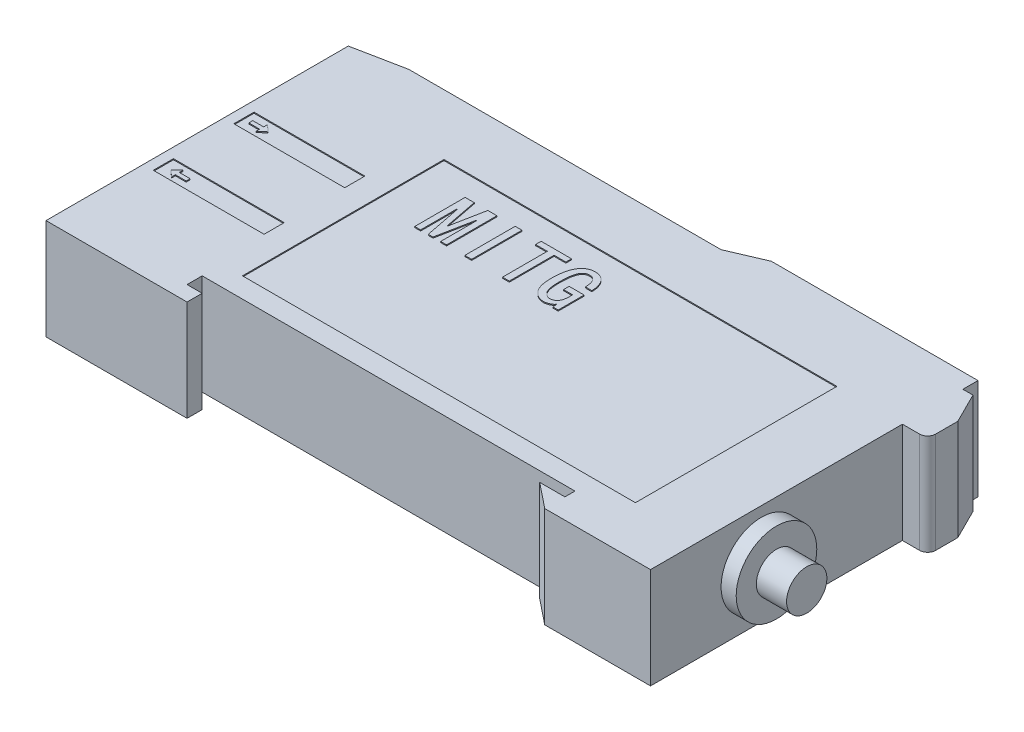
from build123d import *

# Parameters (mm, degrees)
SKETCH_1_W          = 60
SKETCH_1_H          = 31
EXTRUDE_1_DEPTH     = 10
CUT_EXTRUDE_1_DEPTH = 10
EXTRUDE_2_DEPTH     = 10
SKETCH_4_R          = 1
CUT_EXTRUDE_2_DEPTH = 10
SKETCH_5_W          = 39
SKETCH_5_H          = 20
SKETCH_5_W_2        = 0.67251462
SKETCH_5_H_2        = 5
SKETCH_5_W_3        = 11
SKETCH_5_H_3        = 2
CUT_EXTRUDE_3_DEPTH = 0.1
SKETCH_6_R          = 4
EXTRUDE_3_DEPTH     = 1.5
SKETCH_7_R          = 2
EXTRUDE_4_DEPTH     = 3


with BuildPart() as part:
    # 草图1 → 凸台-拉伸1 (new body)
    with BuildSketch(Plane(origin=(0, 0, 0), x_dir=(1, 0, 0), z_dir=(0, 1, 0))):
        with Locations((30, 15.5)):
            Rectangle(SKETCH_1_W, SKETCH_1_H)
    extrude(amount=EXTRUDE_1_DEPTH)

    # 草图2 → 切除-拉伸1 (cut)
    with BuildSketch(Plane(origin=(0, 10, 0), x_dir=(1, 0, 0), z_dir=(0, 1, 0))):
        Polygon((14, 0), (14, 1.5), (12.5, 1.5), (12.5, 3), (49.5, 3), (49.5, 2), (47, 2), (49.5, 0), align=None)
        Polygon((0, 30), (5, 31), (0, 31), align=None)
    extrude(amount=-CUT_EXTRUDE_1_DEPTH, mode=Mode.SUBTRACT)

    # 草图3 → 凸台-拉伸2 (add, through all)
    with BuildSketch(Plane(origin=(0, 10, 0), x_dir=(1, 0, 0), z_dir=(0, 1, 0))):
        with BuildLine():
            Line((61, 31), (60, 31))
            Line((60, 31), (60, 25))
            Line((60, 25), (61.7, 25))
            ThreePointArc((61.7, 25), (62.265685425, 25.234314575), (62.5, 25.8))
            Line((62.5, 25.8), (62.5, 28))
            Line((62.5, 28), (61, 31))
        make_face()
        Polygon((36, 31), (60, 31), (60, 32.5), (39.5, 32.5), align=None)
    extrude(amount=-EXTRUDE_2_DEPTH)

    # 草图4 → 切除-拉伸2 (cut)
    with BuildSketch(Plane.ZY):
        with Locations((-18.5, 5)):
            Circle(SKETCH_4_R)
        with Locations((-10.5, 5)):
            Circle(SKETCH_4_R)
    extrude(amount=-CUT_EXTRUDE_2_DEPTH, mode=Mode.SUBTRACT)

    # 草图5 → 切除-拉伸3 (cut)
    # profile 1 of 3: a face of its own
    with BuildSketch(Plane(origin=(0, 10, 0), x_dir=(1, 0, 0), z_dir=(0, 1, 0))):
        with Locations((34, 15)):
            Rectangle(SKETCH_5_W, SKETCH_5_H)
        Polygon((21.962260416, 17.792968637), (21.377465095, 17.792968637), (21.377465095, 21.360220099), (21.318985562, 21.360220099), (20.617231176, 17.792968637), (20.149394919, 17.792968637), (19.447640533, 21.360220099), (19.389161001, 21.360220099), (19.389161001, 17.792968637), (18.804365679, 17.792968637), (18.804365679, 22.792968637), (19.710798428, 22.792968637), (20.354073282, 19.48887507), (20.412552814, 19.48887507), (21.055827668, 22.792968637), (21.962260416, 22.792968637), align=None, mode=Mode.SUBTRACT)
        with Locations((24.111383223, 20.292968637)):
            Rectangle(SKETCH_5_W_2, SKETCH_5_H_2, mode=Mode.SUBTRACT)
        Polygon((29.359921235, 22.237413081), (28.190330592, 22.237413081), (28.190330592, 17.792968637), (27.517815972, 17.792968637), (27.517815972, 22.237413081), (26.348225329, 22.237413081), (26.348225329, 22.792968637), (29.359921235, 22.792968637), align=None, mode=Mode.SUBTRACT)
        with BuildLine():
            Line((33.102611293, 17.734489105), (32.60553527, 17.734489105))
            Line((32.60553527, 17.734489105), (32.517815972, 18.14384583))
            add(Edge.make_bspline(
                [(32.517815972, 18.14384583), (32.496335049, 18.114894908), (32.452578683, 18.05592225), (32.366892397, 17.979393037), (32.266643174, 17.909470256), (32.151128708, 17.848642528), (32.025699097, 17.798099411), (31.892521927, 17.760859691), (31.75360842, 17.739070297), (31.659108429, 17.736026374), (31.611383223, 17.734489105)],
                knots=[0, 0, 0, 0, 0.837184115, 1.705333332, 2.658671207, 3.677307666, 4.736711015, 5.80083511, 6.889358663, 8, 8, 8, 8], degree=3))
            add(Edge.make_bspline(
                [(31.611383223, 17.734489105), (31.560714868, 17.736021013), (31.46008263, 17.739063531), (31.311817937, 17.76762581), (31.16729555, 17.811965229), (31.027834691, 17.8755244), (30.891473719, 17.955281193), (30.760771836, 18.055054478), (30.632955326, 18.171046345), (30.509527994, 18.304333327), (30.396774962, 18.45853747), (30.297519239, 18.634098702), (30.215913122, 18.832381023), (30.147881926, 19.050856514), (30.096694353, 19.291330684), (30.05919444, 19.552513083), (30.036438806, 19.835379254), (30.033799786, 20.03103084), (30.032435855, 20.132149923)],
                knots=[0, 0, 0, 0, 0.758179789, 1.505818141, 2.253143624, 3.017869083, 3.795858856, 4.614441485, 5.475677495, 6.378750386, 7.330399785, 8.330312341, 9.391702904, 10.535751225, 11.753218739, 13.069914954, 14.485637047, 16, 16, 16, 16], degree=3))
            add(Edge.make_bspline(
                [(30.032435855, 20.132149923), (30.033524015, 20.243005064), (30.035631477, 20.457700531), (30.056303392, 20.768942629), (30.090571093, 21.058155718), (30.137547246, 21.32565553), (30.198737704, 21.571304744), (30.274571201, 21.795097166), (30.362412052, 21.997908599), (30.466184437, 22.177806713), (30.5809145, 22.336396595), (30.705728208, 22.474833232), (30.84257532, 22.589830475), (30.987256047, 22.687082934), (31.14384738, 22.76138369), (31.310614479, 22.812780351), (31.487019509, 22.845452192), (31.607987718, 22.849419101), (31.669862755, 22.851448169)],
                knots=[0, 0, 0, 0, 1.495213205, 2.895810661, 4.205263949, 5.422164245, 6.557127206, 7.616570214, 8.606403325, 9.533523062, 10.412081511, 11.242765381, 12.040838916, 12.817408929, 13.588463244, 14.369296309, 15.165897781, 16, 16, 16, 16], degree=3))
            add(Edge.make_bspline(
                [(31.669862755, 22.851448169), (31.724465447, 22.850157263), (31.831330219, 22.847630786), (31.986728106, 22.823055348), (32.133156944, 22.78417248), (32.270367528, 22.72996005), (32.39858198, 22.660001985), (32.517012997, 22.573895908), (32.626334766, 22.471986726), (32.725227795, 22.355220127), (32.813311094, 22.226144327), (32.892302084, 22.088427367), (32.956880517, 21.940329471), (33.009859712, 21.783333409), (33.052602879, 21.617693101), (33.080734277, 21.442188631), (33.100302009, 21.258143875), (33.101830982, 21.132132363), (33.102611293, 21.067822438)],
                knots=[0, 0, 0, 0, 1.017118894, 1.990637724, 2.924249984, 3.836374462, 4.733711419, 5.639510097, 6.558385009, 7.513001497, 8.485403533, 9.467718841, 10.467915617, 11.491402174, 12.553806325, 13.652248568, 14.801825996, 16, 16, 16, 16], degree=3))
            Line((33.102611293, 21.067822438), (32.45933644, 21.067822438))
            add(Edge.make_bspline(
                [(32.45933644, 21.067822438), (32.458729978, 21.117290953), (32.457551218, 21.213441346), (32.448009389, 21.352666796), (32.431312149, 21.482310098), (32.410867073, 21.602817265), (32.380914637, 21.71323506), (32.347227761, 21.814971363), (32.304498884, 21.905966508), (32.256760295, 21.988236327), (32.203036922, 22.060957155), (32.142500003, 22.123391188), (32.077558088, 22.176617179), (32.007055999, 22.22128447), (31.930094878, 22.254334745), (31.84783057, 22.277999378), (31.760739913, 22.29416845), (31.700622449, 22.295309026), (31.669862755, 22.295892614)],
                knots=[0, 0, 0, 0, 1.442265648, 2.803286258, 4.065667754, 5.252751118, 6.363271917, 7.39841691, 8.373155808, 9.288343585, 10.168233039, 11.001900497, 11.817228588, 12.611567034, 13.426963055, 14.24959516, 15.104388078, 16, 16, 16, 16], degree=3))
            add(Edge.make_bspline(
                [(31.669862755, 22.295892614), (31.631828893, 22.294563094), (31.557924625, 22.291979681), (31.450633434, 22.268061012), (31.350844775, 22.23047274), (31.257857421, 22.177333742), (31.172866818, 22.108722655), (31.097286108, 22.023210173), (31.025577535, 21.925676313), (30.964584262, 21.809804655), (30.908423102, 21.678016537), (30.863297772, 21.525387026), (30.821490016, 21.353610633), (30.790614597, 21.160102718), (30.763920798, 20.947080428), (30.748343708, 20.713136474), (30.735099548, 20.458990692), (30.734500993, 20.282340978), (30.734190241, 20.190629456)],
                knots=[0, 0, 0, 0, 0.713867664, 1.387128832, 2.054865043, 2.71116651, 3.391329963, 4.097256694, 4.850367561, 5.660840087, 6.551597142, 7.538616976, 8.647598492, 9.872123473, 11.218389466, 12.680914074, 14.276824714, 16, 16, 16, 16], degree=3))
            add(Edge.make_bspline(
                [(30.734190241, 20.190629456), (30.73483395, 20.103968299), (30.736071349, 19.937379816), (30.750607233, 19.698223249), (30.772176165, 19.47971091), (30.805076542, 19.282835127), (30.843512642, 19.105844287), (30.894744195, 18.950545195), (30.953134814, 18.815066175), (31.022715541, 18.70062504), (31.098039155, 18.604304965), (31.175512101, 18.520836306), (31.255451263, 18.450044406), (31.338684162, 18.392015675), (31.424300922, 18.345320992), (31.514153456, 18.314560623), (31.605733113, 18.293658802), (31.667942985, 18.291250783), (31.699102521, 18.29004466)],
                knots=[0, 0, 0, 0, 1.763137318, 3.38927359, 4.873732177, 6.228632264, 7.449226689, 8.554896297, 9.551299921, 10.444451664, 11.27164773, 12.035603122, 12.759076972, 13.439665674, 14.096862192, 14.735741838, 15.366761318, 16, 16, 16, 16], degree=3))
            add(Edge.make_bspline(
                [(31.699102521, 18.29004466), (31.72983218, 18.290848844), (31.790132284, 18.292426876), (31.878031693, 18.305615952), (31.961197096, 18.327367151), (32.039477559, 18.357607005), (32.112590811, 18.396886673), (32.180290182, 18.444875026), (32.24233728, 18.502053953), (32.300237525, 18.567322721), (32.352177249, 18.64200929), (32.396916088, 18.726819825), (32.434506327, 18.820857568), (32.464574283, 18.924703583), (32.488267476, 19.037669605), (32.505105864, 19.159978961), (32.516471005, 19.291925027), (32.517356401, 19.383080592), (32.517815972, 19.430395538)],
                knots=[0, 0, 0, 0, 0.926763241, 1.818566216, 2.674466499, 3.515830513, 4.344194496, 5.172200422, 6.012506428, 6.88440238, 7.799833367, 8.749917039, 9.771239203, 10.849892544, 12.007626437, 13.250589984, 14.572899121, 16, 16, 16, 16], degree=3))
            Line((32.517815972, 19.430395538), (32.517815972, 19.752032964))
            Line((32.517815972, 19.752032964), (31.611383223, 19.752032964))
            Line((31.611383223, 19.752032964), (31.611383223, 20.30758852))
            Line((31.611383223, 20.30758852), (33.102611293, 20.30758852))
            Line((33.102611293, 20.30758852), (33.102611293, 17.734489105))
        make_face(mode=Mode.SUBTRACT)
    # profile 2 of 3: a face of its own
    with BuildSketch(Plane(origin=(0, 10, 0), x_dir=(1, 0, 0), z_dir=(0, 1, 0))):
        with Locations((6.5, 18.646769807)):
            Rectangle(SKETCH_5_W_3, SKETCH_5_H_3)
        Polygon((3.383335667, 18.64715665), (2.749062348, 18.08056229), (2.749062348, 18.460605674), (1.671405081, 18.460605674), (1.671405081, 18.851495045), (2.749062348, 18.851495045), (2.749062348, 19.245855132), align=None, mode=Mode.SUBTRACT)
    # profile 3 of 3: a face of its own
    with BuildSketch(Plane(origin=(0, 10, 0), x_dir=(1, 0, 0), z_dir=(0, 1, 0))):
        with Locations((6.5, 10.646769807)):
            Rectangle(SKETCH_5_W_3, SKETCH_5_H_3)
        Polygon((3.551150659, 10.362171108), (2.473927231, 10.362171108), (2.473927231, 9.979524687), (1.834013999, 10.563038787), (2.473927231, 11.138743776), (2.473927231, 10.753060479), (3.551150659, 10.753060479), align=None, mode=Mode.SUBTRACT)
    extrude(amount=-CUT_EXTRUDE_3_DEPTH, mode=Mode.SUBTRACT)

    # 草图6 → 凸台-拉伸3 (add)
    with BuildSketch(Plane(origin=(60, 0, 0), x_dir=(0, 0, -1), z_dir=(1, 0, 0))):
        with Locations(Location((11, 5, 0), (0, 0, 180))):
            Circle(SKETCH_6_R)
    extrude(amount=EXTRUDE_3_DEPTH)

    # 草图7 → 凸台-拉伸4 (add)
    with BuildSketch(Plane(origin=(61.5, 0, 0), x_dir=(0, 0, -1), z_dir=(1, 0, 0))):
        with Locations((11, 5)):
            Circle(SKETCH_7_R)
    extrude(amount=EXTRUDE_4_DEPTH)


solid = part.part
